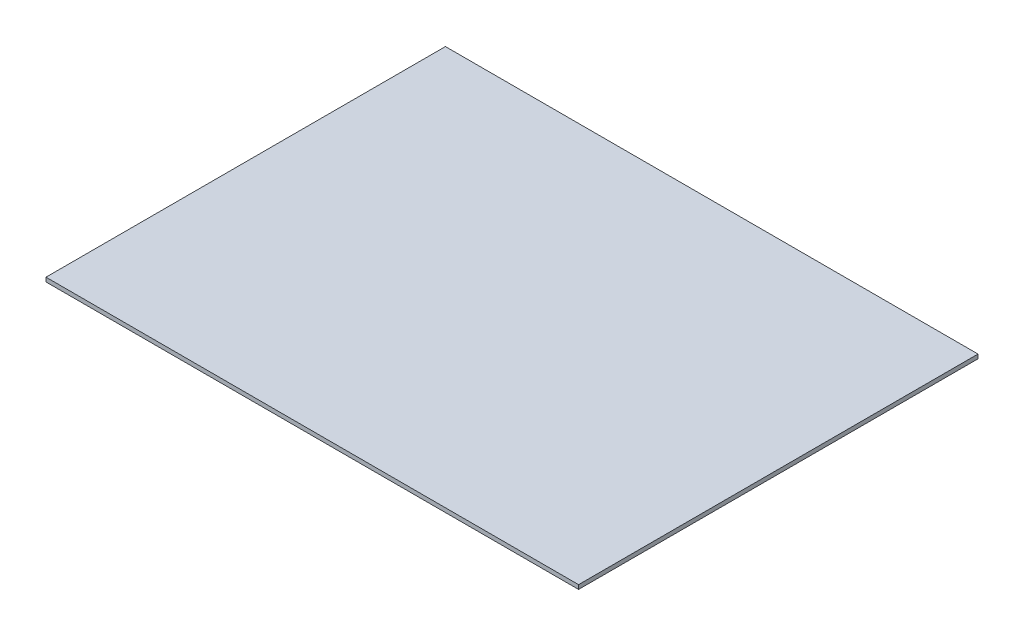
from build123d import *

# Parameters (mm, degrees)
SKETCH1_W           = 406.4
SKETCH1_H           = 304.8
BOSS_EXTRUDE1_DEPTH = 3.175


with BuildPart() as part:
    # Sketch1 → Boss-Extrude1 (new body)
    with BuildSketch(Plane(origin=(0, 0, 0), x_dir=(1, 0, 0), z_dir=(0, 1, 0))):
        with Locations((0, 152.4)):
            Rectangle(SKETCH1_W, SKETCH1_H)
    extrude(amount=BOSS_EXTRUDE1_DEPTH)


solid = part.part
